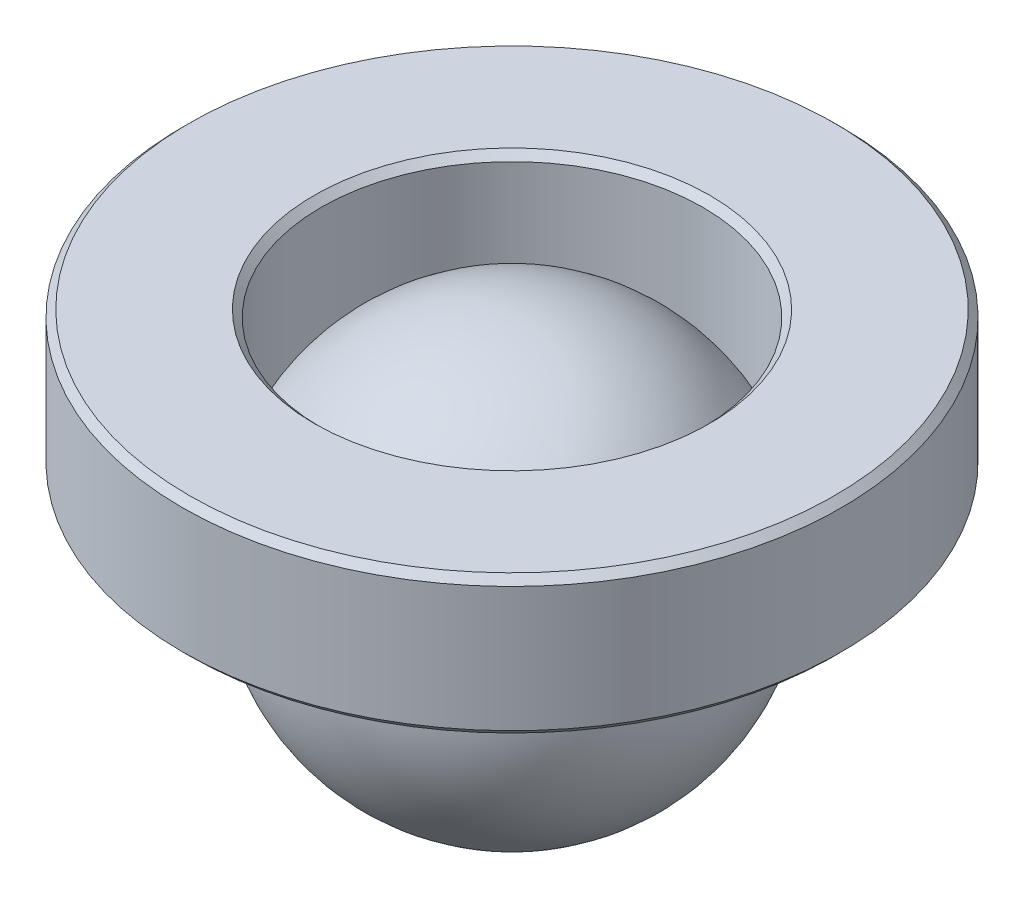
from build123d import *


with BuildPart() as part:
    # Croquis1 → Revolución1 (revolve)
    with BuildSketch(Plane.XY, mode=Mode.PRIVATE) as revoluci_n1_sk:
        Polygon((-2.85, 1.098957881), (-2.75, 1.198957881), (-2.75, 2.998957881), (-2.85, 3.098957881), (-4.65, 3.098957881), (-4.75, 2.998957881), (-4.75, 1.198957881), (-4.65, 1.098957881), align=None)
    revolve(revoluci_n1_sk.sketch.rotate(Axis((0, 3, 0), (0, -1, 0)), 270), axis=Axis((0, 3, 0), (0, -1, 0)))


with BuildPart() as body_2:
    # Croquis2 → Revolución2 (revolve)
    with BuildSketch(Plane.XY):
        with BuildLine():
            Line((0, 3), (0, -3))
            ThreePointArc((0, -3), (-3, 0), (0, 3))
        make_face()
    revolve(axis=Axis((0, 3, 0), (0, -1, 0)))


solid = Compound([part.part, body_2.part])
